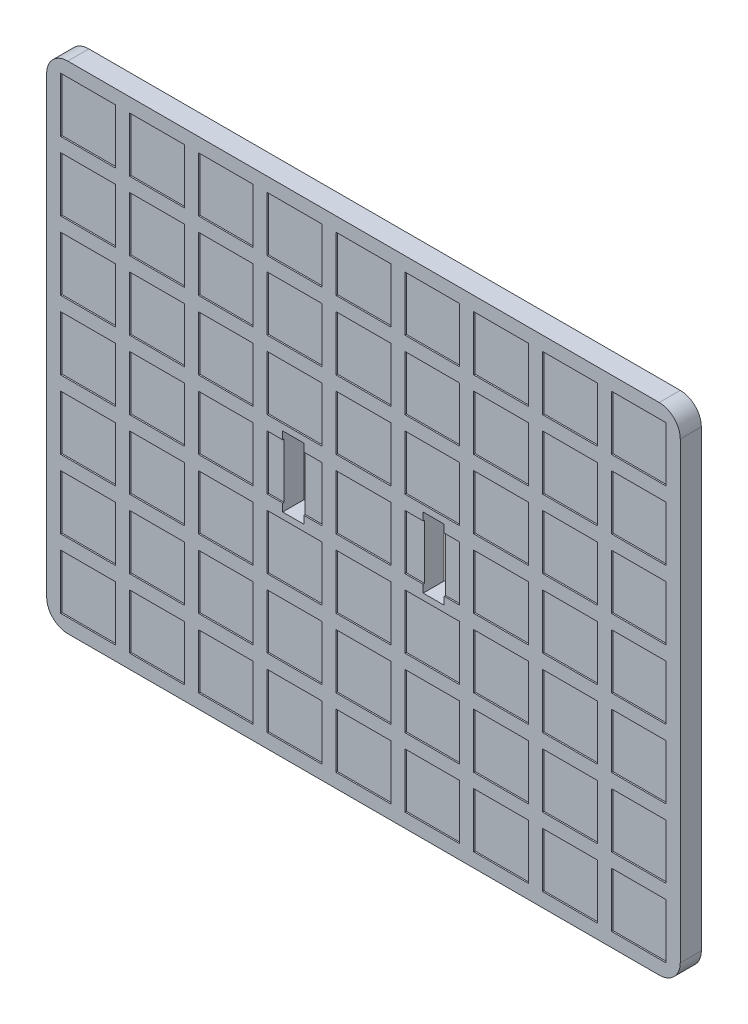
from build123d import *

# Parameters (mm, degrees)
SKETCH1_W           = 3
SKETCH1_H           = 10
BOSS_EXTRUDE1_DEPTH = 3
SKETCH2_W           = 7.8
SKETCH2_H           = 7.8
CUT_EXTRUDE1_DEPTH  = 0.2


with BuildPart() as part:
    # Sketch1 → Boss-Extrude1 (new body)
    with BuildSketch(Plane.XY):
        with BuildLine():
            Line((42.1, 35.3), (-42.1, 35.3))
            ThreePointArc((-42.1, 35.3), (-44.221320344, 34.421320344), (-45.1, 32.3))
            Line((-45.1, 32.3), (-45.1, -32.3))
            ThreePointArc((-45.1, -32.3), (-44.221320344, -34.421320344), (-42.1, -35.3))
            Line((-42.1, -35.3), (42.1, -35.3))
            ThreePointArc((42.1, -35.3), (44.221320344, -34.421320344), (45.1, -32.3))
            Line((45.1, -32.3), (45.1, 32.3))
            ThreePointArc((45.1, 32.3), (44.221320344, 34.421320344), (42.1, 35.3))
        make_face()
        with Locations((-10, 0)):
            Rectangle(SKETCH1_W, SKETCH1_H, mode=Mode.SUBTRACT)
        with Locations((10, 0)):
            Rectangle(SKETCH1_W, SKETCH1_H, mode=Mode.SUBTRACT)
    extrude(amount=BOSS_EXTRUDE1_DEPTH)

    # Sketch2 → Cut-Extrude1 (cut)
    with BuildSketch(Plane.XY.offset(3)):
        with Locations((-39.2, 19.6)):
            Rectangle(SKETCH2_W, SKETCH2_H)
        with Locations((-39.2, 29.4)):
            Rectangle(SKETCH2_W, SKETCH2_H)
        with Locations((-29.4, 29.4)):
            Rectangle(SKETCH2_W, SKETCH2_H)
        with Locations((-19.6, 29.4)):
            Rectangle(SKETCH2_W, SKETCH2_H)
        with Locations((-9.8, 29.4)):
            Rectangle(SKETCH2_W, SKETCH2_H)
        with Locations((0, 29.4)):
            Rectangle(SKETCH2_W, SKETCH2_H)
        with Locations((9.8, 29.4)):
            Rectangle(SKETCH2_W, SKETCH2_H)
        with Locations((19.6, 29.4)):
            Rectangle(SKETCH2_W, SKETCH2_H)
        with Locations((29.4, 29.4)):
            Rectangle(SKETCH2_W, SKETCH2_H)
        with Locations((39.2, 29.4)):
            Rectangle(SKETCH2_W, SKETCH2_H)
        with Locations((-29.4, 19.6)):
            Rectangle(SKETCH2_W, SKETCH2_H)
        with Locations((-19.6, 19.6)):
            Rectangle(SKETCH2_W, SKETCH2_H)
        with Locations((-9.8, 19.6)):
            Rectangle(SKETCH2_W, SKETCH2_H)
        with Locations((0, 19.6)):
            Rectangle(SKETCH2_W, SKETCH2_H)
        with Locations((9.8, 19.6)):
            Rectangle(SKETCH2_W, SKETCH2_H)
        with Locations((19.6, 19.6)):
            Rectangle(SKETCH2_W, SKETCH2_H)
        with Locations((29.4, 19.6)):
            Rectangle(SKETCH2_W, SKETCH2_H)
        with Locations((39.2, 19.6)):
            Rectangle(SKETCH2_W, SKETCH2_H)
        with Locations((-39.2, 0)):
            Rectangle(SKETCH2_W, SKETCH2_H)
        with Locations((-39.2, 9.8)):
            Rectangle(SKETCH2_W, SKETCH2_H)
        with Locations((-29.4, 9.8)):
            Rectangle(SKETCH2_W, SKETCH2_H)
        with Locations((-19.6, 9.8)):
            Rectangle(SKETCH2_W, SKETCH2_H)
        with Locations((-9.8, 9.8)):
            Rectangle(SKETCH2_W, SKETCH2_H)
        with Locations((0, 9.8)):
            Rectangle(SKETCH2_W, SKETCH2_H)
        with Locations((9.8, 9.8)):
            Rectangle(SKETCH2_W, SKETCH2_H)
        with Locations((19.6, 9.8)):
            Rectangle(SKETCH2_W, SKETCH2_H)
        with Locations((29.4, 9.8)):
            Rectangle(SKETCH2_W, SKETCH2_H)
        with Locations((39.2, 9.8)):
            Rectangle(SKETCH2_W, SKETCH2_H)
        with Locations((-29.4, 0)):
            Rectangle(SKETCH2_W, SKETCH2_H)
        with Locations((-19.6, 0)):
            Rectangle(SKETCH2_W, SKETCH2_H)
        with Locations((-9.8, 0)):
            Rectangle(SKETCH2_W, SKETCH2_H)
        Rectangle(SKETCH2_W, SKETCH2_H)
        with Locations((9.8, 0)):
            Rectangle(SKETCH2_W, SKETCH2_H)
        with Locations((19.6, 0)):
            Rectangle(SKETCH2_W, SKETCH2_H)
        with Locations((29.4, 0)):
            Rectangle(SKETCH2_W, SKETCH2_H)
        with Locations((39.2, 0)):
            Rectangle(SKETCH2_W, SKETCH2_H)
        with Locations((-39.2, -19.6)):
            Rectangle(SKETCH2_W, SKETCH2_H)
        with Locations((-39.2, -9.8)):
            Rectangle(SKETCH2_W, SKETCH2_H)
        with Locations((-29.4, -9.8)):
            Rectangle(SKETCH2_W, SKETCH2_H)
        with Locations((-19.6, -9.8)):
            Rectangle(SKETCH2_W, SKETCH2_H)
        with Locations((-9.8, -9.8)):
            Rectangle(SKETCH2_W, SKETCH2_H)
        with Locations((0, -9.8)):
            Rectangle(SKETCH2_W, SKETCH2_H)
        with Locations((9.8, -9.8)):
            Rectangle(SKETCH2_W, SKETCH2_H)
        with Locations((19.6, -9.8)):
            Rectangle(SKETCH2_W, SKETCH2_H)
        with Locations((29.4, -9.8)):
            Rectangle(SKETCH2_W, SKETCH2_H)
        with Locations((39.2, -9.8)):
            Rectangle(SKETCH2_W, SKETCH2_H)
        with Locations((-29.4, -19.6)):
            Rectangle(SKETCH2_W, SKETCH2_H)
        with Locations((-19.6, -19.6)):
            Rectangle(SKETCH2_W, SKETCH2_H)
        with Locations((-9.8, -19.6)):
            Rectangle(SKETCH2_W, SKETCH2_H)
        with Locations((0, -19.6)):
            Rectangle(SKETCH2_W, SKETCH2_H)
        with Locations((9.8, -19.6)):
            Rectangle(SKETCH2_W, SKETCH2_H)
        with Locations((19.6, -19.6)):
            Rectangle(SKETCH2_W, SKETCH2_H)
        with Locations((29.4, -19.6)):
            Rectangle(SKETCH2_W, SKETCH2_H)
        with Locations((39.2, -19.6)):
            Rectangle(SKETCH2_W, SKETCH2_H)
        with Locations((-39.2, -29.4)):
            Rectangle(SKETCH2_W, SKETCH2_H)
        with Locations((-29.4, -29.4)):
            Rectangle(SKETCH2_W, SKETCH2_H)
        with Locations((-19.6, -29.4)):
            Rectangle(SKETCH2_W, SKETCH2_H)
        with Locations((-9.8, -29.4)):
            Rectangle(SKETCH2_W, SKETCH2_H)
        with Locations((0, -29.4)):
            Rectangle(SKETCH2_W, SKETCH2_H)
        with Locations((9.8, -29.4)):
            Rectangle(SKETCH2_W, SKETCH2_H)
        with Locations((19.6, -29.4)):
            Rectangle(SKETCH2_W, SKETCH2_H)
        with Locations((29.4, -29.4)):
            Rectangle(SKETCH2_W, SKETCH2_H)
        with Locations((39.2, -29.4)):
            Rectangle(SKETCH2_W, SKETCH2_H)
    extrude(amount=-CUT_EXTRUDE1_DEPTH, mode=Mode.SUBTRACT)


solid = part.part
